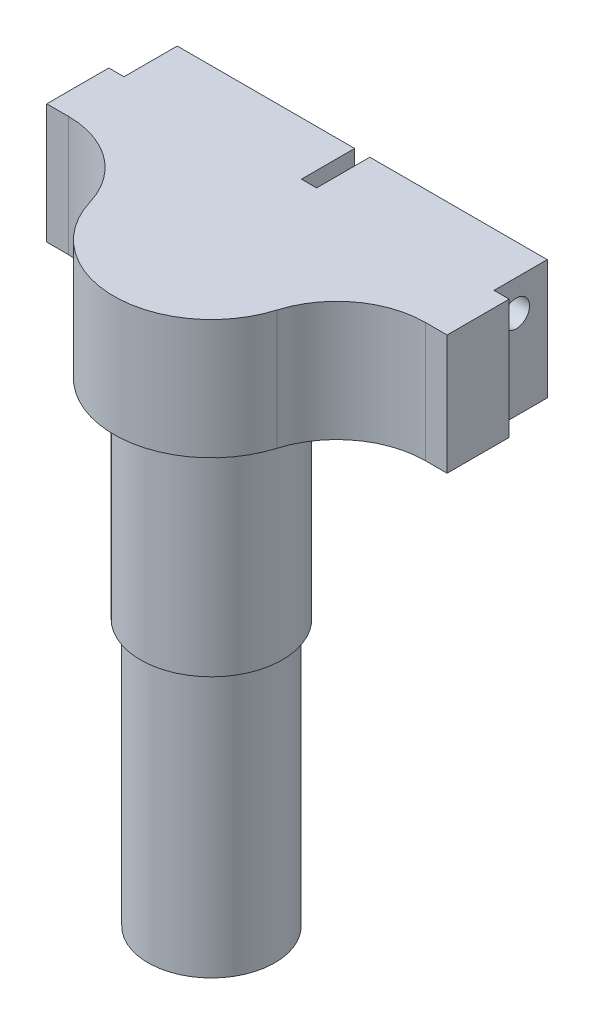
from build123d import *

# Parameters (mm, degrees)
SKETCH1_R            = 11
SKETCH1_R_2          = 8
SKETCH1_W            = 45.13
SKETCH1_H            = 7
BOSS_EXTRUDE1_DEPTH  = 10
SKETCH2_W            = 1.71
SKETCH2_H            = 4
CUT_EXTRUDE1_DEPTH   = 10
SKETCH3_W            = 20
SKETCH3_H            = 10
BOSS_EXTRUDE2_DEPTH  = 3
CUT_EXTRUDE2_START   = -3
CUT_EXTRUDE2_DEPTH   = 3
SKETCH6_W            = 20
SKETCH6_H            = 7
BOSS_EXTRUDE3_DEPTH  = 2
SKETCH7_R            = 1.5
CUT_EXTRUDE5_DEPTH   = 44
SKETCH9_W            = 1.71
SKETCH9_H            = 7
BOSS_EXTRUDE4_DEPTH  = 3
CUT_EXTRUDE6_START   = -1
SKETCH11_R           = 8
CUT_EXTRUDE6_DEPTH   = 1
BOSS_EXTRUDE6_DEPTH  = 1
BOSS_EXTRUDE7_START  = 6
SKETCH13_R           = 8
BOSS_EXTRUDE7_DEPTH  = 6
SKETCH14_R           = 8
BOSS_EXTRUDE8_DEPTH  = 40
SKETCH15_R           = 7.5
BOSS_EXTRUDE9_DEPTH  = 30
BOSS_EXTRUDE10_START = 6.5
BOSS_EXTRUDE10_DEPTH = 6.5
SKETCH17_R           = 15.773418916
SKETCH17_R_2         = 7
CUT_EXTRUDE7_DEPTH   = 30
SKETCH18_R           = 7.1
BOSS_EXTRUDE11_DEPTH = 30
SKETCH19_R           = 7.2
BOSS_EXTRUDE12_DEPTH = 30
SKETCH20_R           = 12.810748173
SKETCH20_R_2         = 7.15
CUT_EXTRUDE8_DEPTH   = 30
SKETCH21_R           = 7.15
CUT_EXTRUDE9_DEPTH   = 10
SKETCH22_R           = 8
SKETCH22_R_2         = 7.15
CUT_EXTRUDE10_DEPTH  = 10
SKETCH25_W           = 1.71
SKETCH25_H           = 3
SKETCH25_W_2         = 20
CUT_EXTRUDE13_DEPTH  = 21
BOSS_EXTRUDE13_DEPTH = 20
BOSS_EXTRUDE14_START = -20
BOSS_EXTRUDE14_DEPTH = 20
SKETCH28_R           = 1.5
CUT_EXTRUDE14_DEPTH  = 50
SKETCH29_W           = 45.13
SKETCH29_H           = 13.5
BOSS_EXTRUDE15_DEPTH = 4
FILLET1_R            = 10
FILLET2_R            = 2


with BuildPart() as part:
    # Sketch1 → Boss-Extrude1 (new body)
    # profile 1 of 2: a face of its own
    with BuildSketch(Plane(origin=(0, 0, 0), x_dir=(1, 0, 0), z_dir=(0, 1, 0))):
        with Locations((22.565, -8)):
            Circle(SKETCH1_R)
        with Locations(Location((22.565, -8, 0), (0, 0, 270))):
            Circle(SKETCH1_R_2, mode=Mode.SUBTRACT)
    # profile 2 of 2: a face of its own
    with BuildSketch(Plane(origin=(0, 0, 0), x_dir=(1, 0, 0), z_dir=(0, 1, 0))):
        with Locations((22.565, 3.5)):
            Rectangle(SKETCH1_W, SKETCH1_H)
    extrude(amount=BOSS_EXTRUDE1_DEPTH)

    # Sketch2 → Cut-Extrude1 (cut)
    with BuildSketch(Plane(origin=(0, 10, 0), x_dir=(1, 0, 0), z_dir=(0, 1, 0))):
        with Locations((0.855, 5)):
            Rectangle(SKETCH2_W, SKETCH2_H)
        with Locations((22.565, 5)):
            Rectangle(SKETCH2_W, SKETCH2_H)
        with Locations((44.275, 5)):
            Rectangle(SKETCH2_W, SKETCH2_H)
    extrude(amount=-CUT_EXTRUDE1_DEPTH, mode=Mode.SUBTRACT)

    # Sketch3 → Boss-Extrude2 (add)
    with BuildSketch(Plane(origin=(0, 0, -7), x_dir=(-1, 0, 0), z_dir=(0, 0, -1))):
        with Locations((-33.42, 5)):
            Rectangle(SKETCH3_W, SKETCH3_H)
        with Locations((-11.71, 5)):
            Rectangle(SKETCH3_W, SKETCH3_H)
    extrude(amount=BOSS_EXTRUDE2_DEPTH)

    # Sketch4 → Cut-Extrude2 (cut)
    with BuildSketch(Plane(origin=(0, 10, 0), x_dir=(1, 0, 0), z_dir=(0, 1, 0)).offset(CUT_EXTRUDE2_START)):
        with BuildLine():
            Line((21.71, 3), (21.71, 10))
            Line((21.71, 10), (1.71, 10))
            Line((1.71, 10), (1.71, 3))
            Line((1.71, 3), (0, 3))
            Line((0, 3), (0, 0))
            Line((0, 0), (15.015165565, 0))
            ThreePointArc((15.015165565, 0), (22.565, -19), (30.114834435, 0))
            Line((30.114834435, 0), (45.13, 0))
            Line((45.13, 0), (45.13, 3))
            Line((45.13, 3), (43.42, 3))
            Line((43.42, 3), (43.42, 10))
            Line((43.42, 10), (23.42, 10))
            Line((23.42, 10), (23.42, 3))
            Line((23.42, 3), (21.71, 3))
        make_face()
    extrude(amount=CUT_EXTRUDE2_DEPTH, mode=Mode.SUBTRACT)

    # Sketch6 → Boss-Extrude3 (add)
    with BuildSketch(Plane(origin=(0, 0, -10), x_dir=(-1, 0, 0), z_dir=(0, 0, -1))):
        with Locations((-33.42, 3.5)):
            Rectangle(SKETCH6_W, SKETCH6_H)
        with Locations((-11.71, 3.5)):
            Rectangle(SKETCH6_W, SKETCH6_H)
    extrude(amount=BOSS_EXTRUDE3_DEPTH)

    # Sketch7 → Cut-Extrude5 (cut)
    with BuildSketch(Plane.ZY.offset(-1.71)):
        with Locations((-8.5, 3.5)):
            Circle(SKETCH7_R)
    extrude(amount=-CUT_EXTRUDE5_DEPTH, mode=Mode.SUBTRACT)

    # Sketch9 → Boss-Extrude4 (add)
    with BuildSketch(Plane(origin=(0, 0, -3), x_dir=(-1, 0, 0), z_dir=(0, 0, -1))):
        with Locations((-22.565, 3.5)):
            Rectangle(SKETCH9_W, SKETCH9_H)
        with Locations((-0.855, 3.5)):
            Rectangle(SKETCH9_W, SKETCH9_H)
        with Locations((-44.275, 3.5)):
            Rectangle(SKETCH9_W, SKETCH9_H)
    extrude(amount=BOSS_EXTRUDE4_DEPTH)

    # Sketch11 → Cut-Extrude6 (cut)
    with BuildSketch(Plane(origin=(0, 7, 0), x_dir=(1, 0, 0), z_dir=(0, 1, 0)).offset(CUT_EXTRUDE6_START)):
        with BuildLine():
            Line((45.13, 6), (43.42, 6))
            Line((43.42, 6), (43.42, 12))
            Line((43.42, 12), (23.42, 12))
            Line((23.42, 12), (23.42, 6))
            Line((23.42, 6), (21.71, 6))
            Line((21.71, 6), (21.71, 12))
            Line((21.71, 12), (1.71, 12))
            Line((1.71, 12), (1.71, 6))
            Line((1.71, 6), (0, 6))
            Line((0, 6), (0, 0))
            Line((0, 0), (15.015165565, 0))
            ThreePointArc((15.015165565, 0), (22.565, -19), (30.114834435, 0))
            Line((30.114834435, 0), (45.13, 0))
            Line((45.13, 0), (45.13, 6))
        make_face()
        with Locations(Location((22.565, -8, 0), (0, 0, 270))):
            Circle(SKETCH11_R, mode=Mode.SUBTRACT)
    extrude(amount=CUT_EXTRUDE6_DEPTH, mode=Mode.SUBTRACT)

    # Sketch12 → Boss-Extrude6 (add)
    with BuildSketch(Plane(origin=(0, 6, 0), x_dir=(1, 0, 0), z_dir=(0, 1, 0))):
        with BuildLine():
            Line((45.13, 0), (45.13, 6))
            Line((45.13, 6), (43.42, 6))
            Line((43.42, 6), (43.42, 12))
            Line((43.42, 12), (23.42, 12))
            Line((23.42, 12), (23.42, 6))
            Line((23.42, 6), (21.71, 6))
            Line((21.71, 6), (21.71, 12))
            Line((21.71, 12), (1.71, 12))
            Line((1.71, 12), (1.71, 6))
            Line((1.71, 6), (0, 6))
            Line((0, 6), (0, 0))
            Line((0, 0), (15.015165565, 0))
            ThreePointArc((15.015165565, 0), (22.565, -19), (30.114834435, 0))
            Line((30.114834435, 0), (45.13, 0))
        make_face()
    extrude(amount=BOSS_EXTRUDE6_DEPTH)

    # Sketch13 → Boss-Extrude7 (add)
    with BuildSketch(Plane.XZ.offset(-6).offset(BOSS_EXTRUDE7_START)):
        with Locations((22.565, 8)):
            Circle(SKETCH13_R)
    extrude(amount=-BOSS_EXTRUDE7_DEPTH)

    # Sketch14 → Boss-Extrude8 (add)
    with BuildSketch(Plane.XZ):
        with Locations(Location((22.565, 8, 0), (0, 0, 90))):
            Circle(SKETCH14_R)
    extrude(amount=BOSS_EXTRUDE8_DEPTH)

    # Sketch15 → Boss-Extrude9 (add)
    with BuildSketch(Plane.XZ.offset(40)):
        with Locations(Location((22.565, 8, 0), (0, 0, 270))):
            Circle(SKETCH15_R)
    extrude(amount=BOSS_EXTRUDE9_DEPTH)

    # Sketch16 → Boss-Extrude10 (add)
    with BuildSketch(Plane.XZ.offset(BOSS_EXTRUDE10_START)):
        with BuildLine():
            Line((43.42, -12), (43.42, -6))
            Line((43.42, -6), (45.13, -6))
            Line((45.13, -6), (45.13, 0))
            Line((45.13, 0), (30.114834435, 0))
            ThreePointArc((30.114834435, 0), (22.565, 19), (15.015165565, 0))
            Line((15.015165565, 0), (0, 0))
            Line((0, 0), (0, -6))
            Line((0, -6), (1.71, -6))
            Line((1.71, -6), (1.71, -12))
            Line((1.71, -12), (21.71, -12))
            Line((21.71, -12), (21.71, -6))
            Line((21.71, -6), (23.42, -6))
            Line((23.42, -6), (23.42, -12))
            Line((23.42, -12), (43.42, -12))
        make_face()
    extrude(amount=-BOSS_EXTRUDE10_DEPTH)

    # Sketch17 → Cut-Extrude7 (cut)
    with BuildSketch(Plane.XZ.offset(70)):
        with Locations((22.565, 8)):
            Circle(SKETCH17_R)
        with Locations(Location((22.565, 8, 0), (0, 0, 270))):
            Circle(SKETCH17_R_2, mode=Mode.SUBTRACT)
    extrude(amount=-CUT_EXTRUDE7_DEPTH, mode=Mode.SUBTRACT)

    # Sketch18 → Boss-Extrude11 (add)
    with BuildSketch(Plane.XZ.offset(70)):
        with Locations(Location((22.565, 8, 0), (0, 0, 270))):
            Circle(SKETCH18_R)
    extrude(amount=-BOSS_EXTRUDE11_DEPTH)

    # Sketch19 → Boss-Extrude12 (add)
    with BuildSketch(Plane.XZ.offset(70)):
        with Locations(Location((22.565, 8, 0), (0, 0, 270))):
            Circle(SKETCH19_R)
    extrude(amount=-BOSS_EXTRUDE12_DEPTH)

    # Sketch20 → Cut-Extrude8 (cut)
    with BuildSketch(Plane.XZ.offset(70)):
        with Locations((22.565, 8)):
            Circle(SKETCH20_R)
        with Locations(Location((22.565, 8, 0), (0, 0, 270))):
            Circle(SKETCH20_R_2, mode=Mode.SUBTRACT)
    extrude(amount=-CUT_EXTRUDE8_DEPTH, mode=Mode.SUBTRACT)

    # Sketch21 → Cut-Extrude9 (cut)
    with BuildSketch(Plane.XZ.offset(70)):
        with Locations(Location((22.565, 8, 0), (0, 0, 270))):
            Circle(SKETCH21_R)
    extrude(amount=-CUT_EXTRUDE9_DEPTH, mode=Mode.SUBTRACT)

    # Sketch22 → Cut-Extrude10 (cut)
    with BuildSketch(Plane.XZ.offset(40)):
        with Locations(Location((22.565, 8, 0), (0, 0, 270))):
            Circle(SKETCH22_R)
        with Locations(Location((22.565, 8, 0), (0, 0, 270))):
            Circle(SKETCH22_R_2, mode=Mode.SUBTRACT)
    extrude(amount=-CUT_EXTRUDE10_DEPTH, mode=Mode.SUBTRACT)

    # Sketch25 → Cut-Extrude13 (cut)
    with BuildSketch(Plane(origin=(0, 7, 0), x_dir=(1, 0, 0), z_dir=(0, 1, 0))):
        with Locations((0.855, 4.5)):
            Rectangle(SKETCH25_W, SKETCH25_H)
        with Locations((11.71, 10.5)):
            Rectangle(SKETCH25_W_2, SKETCH25_H)
        with Locations((33.42, 10.5)):
            Rectangle(SKETCH25_W_2, SKETCH25_H)
        with Locations((22.565, 4.5)):
            Rectangle(SKETCH25_W, SKETCH25_H)
        with Locations((44.275, 4.5)):
            Rectangle(SKETCH25_W, SKETCH25_H)
    extrude(amount=-CUT_EXTRUDE13_DEPTH, mode=Mode.SUBTRACT)

    # Sketch26 → Boss-Extrude13 (add)
    with BuildSketch(Plane.ZY.offset(-1.71)):
        with BuildLine():
            ThreePointArc((-7, 3.5), (-7.633974596, 4.724744871), (-9, 4.914213562))
            Line((-9, 4.914213562), (-9, 2.085786438))
            ThreePointArc((-9, 2.085786438), (-7.633974596, 2.275255129), (-7, 3.5))
        make_face()
    extrude(amount=-BOSS_EXTRUDE13_DEPTH)

    # Sketch27 → Boss-Extrude14 (add)
    with BuildSketch(Plane(origin=(43.42, 0, 0), x_dir=(0, 0, -1), z_dir=(1, 0, 0)).offset(BOSS_EXTRUDE14_START)):
        with BuildLine():
            Line((9, 2.085786438), (9, 4.914213562))
            ThreePointArc((9, 4.914213562), (7, 3.5), (9, 2.085786438))
        make_face()
    extrude(amount=BOSS_EXTRUDE14_DEPTH)

    # Sketch28 → Cut-Extrude14 (cut)
    with BuildSketch(Plane.ZY.offset(-1.71)):
        with Locations((-5.5, 3.5)):
            Circle(SKETCH28_R)
    extrude(amount=-CUT_EXTRUDE14_DEPTH, mode=Mode.SUBTRACT)

    # Sketch29 → Boss-Extrude15 (add)
    with BuildSketch(Plane.XY):
        with Locations((22.565, 0.25)):
            Rectangle(SKETCH29_W, SKETCH29_H)
    extrude(amount=BOSS_EXTRUDE15_DEPTH)

    # Fillet1
    fillet1_edges = [part.edges().sort_by_distance(p)[0] for p in [
        (32.811950766, 0.25, 4),
        (12.318049234, 0.25, 4),
    ]]
    fillet(fillet1_edges, radius=FILLET1_R)

    # Fillet2
    fillet2_edges = [part.edges().sort_by_distance(p)[0] for p in [
        (22.565, -6.5, 0),
    ]]
    fillet(fillet2_edges, radius=FILLET2_R)


solid = part.part
